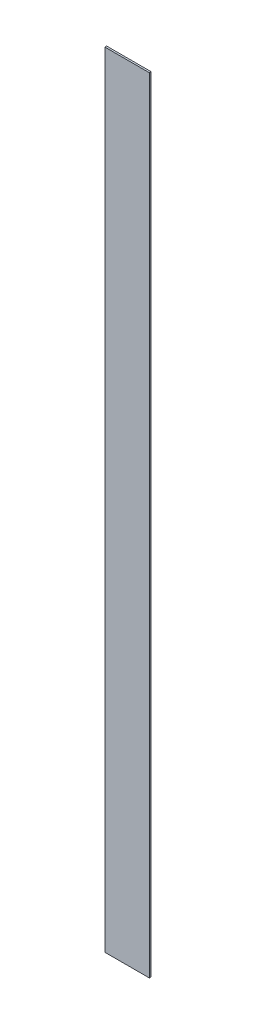
from build123d import *

# Parameters (mm, degrees)
SKETCH_1_W      = 50
SKETCH_1_H      = 880
EXTRUDE_1_DEPTH = 1


with BuildPart() as part:
    # Эскиз1 → Бобышка-Вытянуть1 (new, symmetric)
    with BuildSketch(Plane.XY):
        Rectangle(SKETCH_1_W, SKETCH_1_H)
    extrude(amount=EXTRUDE_1_DEPTH, both=True)


solid = part.part
